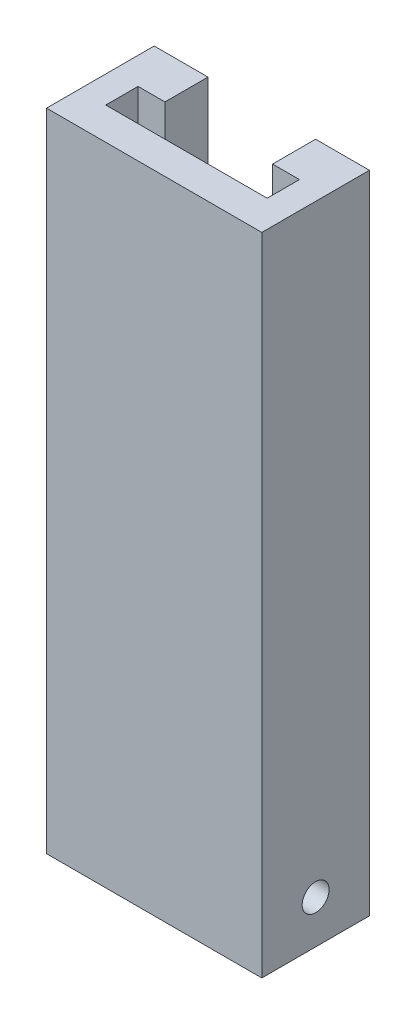
from build123d import *

# Parameters (mm, degrees)
SZKIC1_W                    = 40
SZKIC1_H                    = 20
DODANIE_WYCI_GNI_CIE1_DEPTH = 120
SZKIC2_R                    = 2.5
WYTNIJ_WYCI_GNI_CIE1_DEPTH  = 127.885775404
WYTNIJ_WYCI_GNI_CIE2_DEPTH  = 104


with BuildPart() as part:
    # Szkic1 → Dodanie-wyciągnięcie1 (new body)
    with BuildSketch(Plane(origin=(0, 0, 0), x_dir=(1, 0, 0), z_dir=(0, 1, 0))):
        Rectangle(SZKIC1_W, SZKIC1_H)
    extrude(amount=DODANIE_WYCI_GNI_CIE1_DEPTH)

    # Szkic2 → Wytnij-wyciągnięcie1 (cut, through all)
    with BuildSketch(Plane.ZY.offset(20)):
        with Locations((0, 8)):
            Circle(SZKIC2_R)
    extrude(amount=-WYTNIJ_WYCI_GNI_CIE1_DEPTH, mode=Mode.SUBTRACT)

    # Szkic4 → Wytnij-wyciągnięcie2 (cut)
    with BuildSketch(Plane(origin=(0, 120, 0), x_dir=(1, 0, 0), z_dir=(0, 1, 0))):
        Polygon((-15, -4), (15, -4), (15, 2), (10, 2), (10, 10), (-10, 10), (-10, 2), (-15, 2), align=None)
    extrude(amount=-WYTNIJ_WYCI_GNI_CIE2_DEPTH, mode=Mode.SUBTRACT)


solid = part.part
